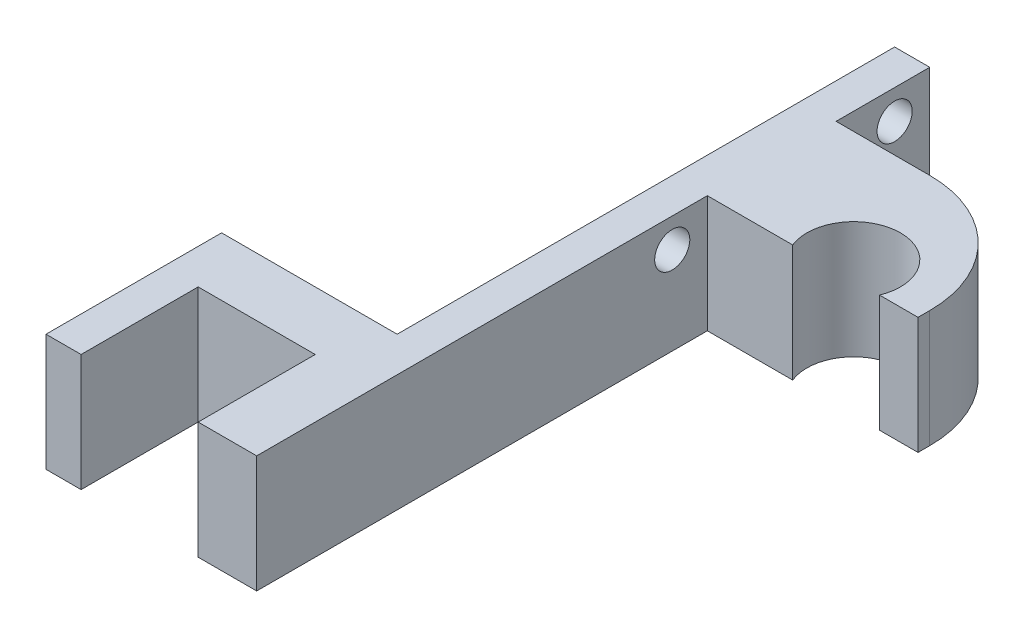
from build123d import *

# Parameters (mm, degrees)
BOSS_EXTRUDE1_DEPTH = 10
SKETCH2_R           = 4
CUT_EXTRUDE1_DEPTH  = 50.348252249
SKETCH3_R           = 1.5
CUT_EXTRUDE2_DEPTH  = 50.348252249
SKETCH5_W           = 42.5
SKETCH5_H           = 10
CUT_EXTRUDE4_DEPTH  = 2
FILLET1_R           = 10


with BuildPart() as part:
    # Sketch1 → Boss-Extrude1 (new body)
    with BuildSketch(Plane(origin=(0, 0, 0), x_dir=(1, 0, 0), z_dir=(0, 1, 0))):
        Polygon((0, 0), (0, 34), (0, 42.5), (5, 42.5), (5, 34.5), (23, 34.5), (23, 23.5), (5, 23.5), (5, -15), (0, -15), (0, -5), (-10, -5), (-10, -15), (-13, -15), (-13, 0), align=None)
    extrude(amount=BOSS_EXTRUDE1_DEPTH)

    # Sketch2 → Cut-Extrude1 (cut, through all)
    with BuildSketch(Plane(origin=(0, 10, 0), x_dir=(1, 0, 0), z_dir=(0, 1, 0))):
        with Locations((16, 25)):
            Circle(SKETCH2_R)
    extrude(amount=-CUT_EXTRUDE1_DEPTH, mode=Mode.SUBTRACT)

    # Sketch3 → Cut-Extrude2 (cut, through all)
    with BuildSketch(Plane.ZY):
        with Locations((-39.5, 7.5)):
            Circle(SKETCH3_R)
        with Locations((-20.5, 7.5)):
            Circle(SKETCH3_R)
    extrude(amount=-CUT_EXTRUDE2_DEPTH, mode=Mode.SUBTRACT)

    # Sketch5 → Cut-Extrude4 (cut)
    with BuildSketch(Plane.ZY):
        with Locations((-21.25, 5)):
            Rectangle(SKETCH5_W, SKETCH5_H)
    extrude(amount=-CUT_EXTRUDE4_DEPTH, mode=Mode.SUBTRACT)

    # Fillet1
    fillet1_edges = [part.edges().sort_by_distance(p)[0] for p in [
        (23, 5, -34.5),
    ]]
    fillet(fillet1_edges, radius=FILLET1_R)


solid = part.part
